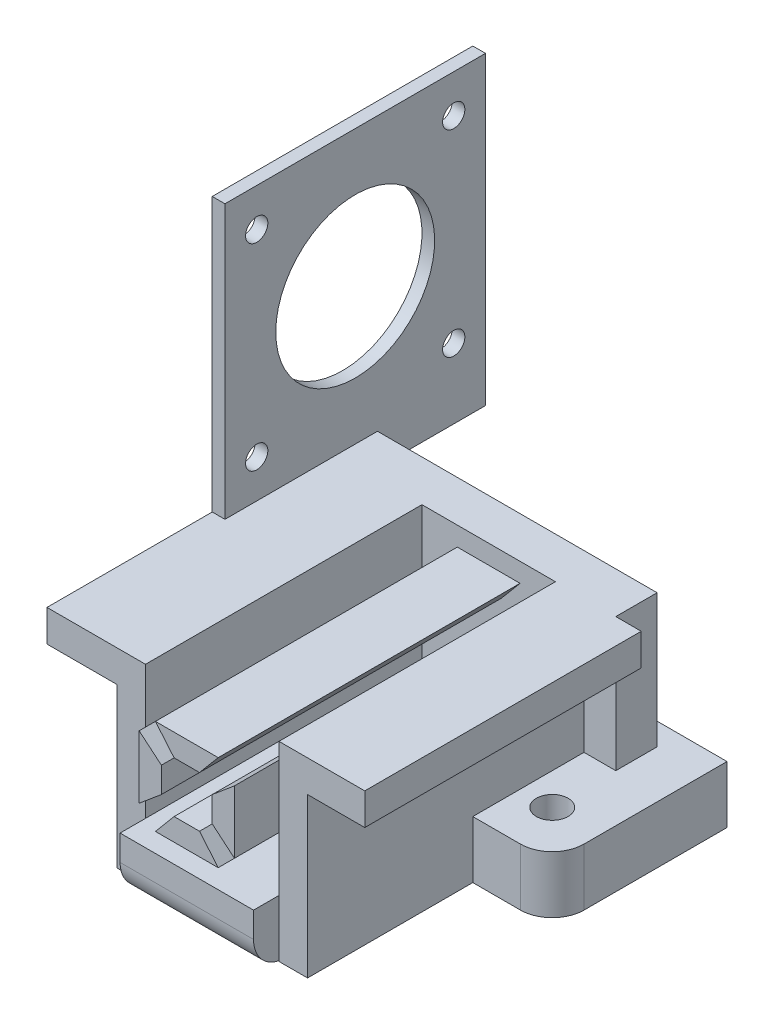
from build123d import *

# Parameters (mm, degrees)
BOSS_EXTRUDE2_DEPTH          = 8
BOSS_EXTRUDE2_DEPTH_BACK     = 1
SKETCH1_R                    = 2.5
CUT_EXTRUDE1_DEPTH           = 79.300702423
CUT_EXTRUDE1_DEPTH_BACK      = 79.300702423
SKETCH2_R                    = 2.5
SKETCH3_R                    = 3.25
CUT_EXTRUDE5_DEPTH           = 15
CUT_EXTRUDE5_DRAFT           = -0.0573
CUT_EXTRUDE5_PROFILE_2_DEPTH = 15
CUT_EXTRUDE5_PROFILE_2_DRAFT = -0.0573
SKETCH5_W                    = 4.5
SKETCH5_H                    = 6.5
BOSS_EXTRUDE3_DEPTH          = 14.5
SKETCH6_R                    = 4
CUT_EXTRUDE4_DEPTH           = 1.5
SKETCH12_W                   = 10.5
SKETCH12_H                   = 30
BOSS_EXTRUDE7_DEPTH          = 9
SKETCH15_W                   = 9
SKETCH15_H                   = 6.5
BOSS_EXTRUDE8_DEPTH          = 3.5
BOSS_EXTRUDE9_DEPTH          = 54
FILLET4_R                    = 5
SKETCH18_W                   = 9.873697418
SKETCH18_H                   = 6.5
BOSS_EXTRUDE11_DEPTH         = 0.5
SKETCH20_W                   = 4
SKETCH20_H                   = 17.5
BOSS_EXTRUDE12_DEPTH         = 18
BOSS_EXTRUDE13_DEPTH         = 11
BOSS_EXTRUDE13_DEPTH_BACK    = 4
SKETCH22_W                   = 17.5
SKETCH22_H                   = 4
SKETCH25_W                   = 2
SKETCH25_H                   = 17.5
BOSS_EXTRUDE14_DEPTH         = 41
SKETCH28_W                   = 41
SKETCH28_H                   = 45
BOSS_EXTRUDE15_DEPTH         = 2
SKETCH29_R                   = 1.75
CUT_EXTRUDE8_DEPTH           = 9
BOSS_EXTRUDE16_DEPTH         = 9
BOSS_EXTRUDE16_DEPTH_BACK    = 4
SKETCH30_W                   = 17.5
SKETCH30_H                   = 2
CUT_EXTRUDE9_DEPTH           = 9
SKETCH32_W                   = 13
SKETCH32_H                   = 4
BOSS_EXTRUDE17_DEPTH         = 23.5
SKETCH33_W                   = 0.5
SKETCH33_H                   = 17.5
BOSS_EXTRUDE18_DEPTH         = 20
SKETCH34_W                   = 4.5
SKETCH34_H                   = 25
SKETCH34_W_2                 = 15.5
SKETCH34_H_2                 = 4
SKETCH34_W_3                 = 9
BOSS_EXTRUDE19_DEPTH         = 26
SKETCH35_W                   = 9.873697418
SKETCH35_H                   = 0.5
BOSS_EXTRUDE20_DEPTH         = 47.5
BOSS_EXTRUDE21_DEPTH         = 47.5
SKETCH38_W                   = 0.419549816
SKETCH38_H                   = 18.5
CUT_EXTRUDE10_DEPTH          = 90.5
SKETCH46_W                   = 22.5
SKETCH46_H                   = 9
SKETCH46_W_2                 = 5
BOSS_EXTRUDE26_DEPTH         = 11.5
SKETCH47_W                   = 27.5
SKETCH47_H                   = 9
BOSS_EXTRUDE27_DEPTH         = 11
SKETCH48_W                   = 5
SKETCH48_H                   = 6.5
BOSS_EXTRUDE31_DEPTH         = 18.5
SKETCH50_R                   = 4
CUT_EXTRUDE11_DEPTH          = 1.5
SKETCH51_W                   = 9.626242636
SKETCH51_H                   = 9.125298808
BOSS_EXTRUDE32_DEPTH         = 1.5
BOSS_EXTRUDE35_DEPTH         = 47.5
SKETCH55_W                   = 9.873697418
SKETCH55_H                   = 0.5
CUT_EXTRUDE12_DEPTH          = 47.5
BOSS_EXTRUDE37_DEPTH         = 47.5
CUT_EXTRUDE17_DEPTH          = 47.5
SKETCH62_W                   = 8
SKETCH62_H                   = 8
CUT_EXTRUDE18_DEPTH          = 47.5
SKETCH63_W                   = 13
SKETCH63_H                   = 4
CUT_EXTRUDE20_DEPTH          = 17
SKETCH64_W                   = 0.5
SKETCH64_H                   = 1.5
BOSS_EXTRUDE38_DEPTH         = 6.5
SKETCH65_W                   = 7
SKETCH65_H                   = 3
CUT_EXTRUDE21_DEPTH          = 1.5
BOSS_EXTRUDE39_START         = -2
BOSS_EXTRUDE39_DEPTH         = 2
CUT_EXTRUDE22_DEPTH          = 155
BOSS_EXTRUDE40_DEPTH         = 1.5
SKETCH70_W                   = 2
SKETCH70_H                   = 41
BOSS_EXTRUDE41_DEPTH         = 3
BOSS_EXTRUDE42_DEPTH         = 1


with BuildPart() as part:
    # Sketch1 → Boss-Extrude2 (new, two sides: drawn at the far end of the back side and taken through both)
    with BuildSketch(Plane(origin=(0, 0, 0), x_dir=(1, 0, 0), z_dir=(0, 1, 0)).offset(-BOSS_EXTRUDE2_DEPTH_BACK)):
        with BuildLine():
            Line((5, 0), (50, 0))
            ThreePointArc((50, 0), (53.535533906, 1.464466094), (55, 5))
            Line((55, 5), (55, 50))
            ThreePointArc((55, 50), (53.535533906, 53.535533906), (50, 55))
            Line((50, 55), (5, 55))
            ThreePointArc((5, 55), (1.464466094, 53.535533906), (0, 50))
            Line((0, 50), (0, 5))
            ThreePointArc((0, 5), (1.464466094, 1.464466094), (5, 0))
        make_face()
        with Locations(Location((7.5, 47.5, 0), (0, 0, 270))):
            Circle(SKETCH1_R, mode=Mode.SUBTRACT)
        with Locations(Location((47.5, 47.5, 0), (0, 0, 270))):
            Circle(SKETCH1_R, mode=Mode.SUBTRACT)
        with Locations(Location((47.5, 7.5, 0), (0, 0, 270))):
            Circle(SKETCH1_R, mode=Mode.SUBTRACT)
        with Locations(Location((7.5, 7.5, 0), (0, 0, 270))):
            Circle(SKETCH1_R, mode=Mode.SUBTRACT)
    extrude(amount=BOSS_EXTRUDE2_DEPTH + BOSS_EXTRUDE2_DEPTH_BACK)

    # Sketch2 → Cut-Extrude1 (cut, two sides: drawn at the far end of the back side and taken through both)
    with BuildSketch(Plane(origin=(0, 8, 0), x_dir=(1, 0, 0), z_dir=(0, 1, 0)).offset(-CUT_EXTRUDE1_DEPTH_BACK)):
        with BuildLine():
            Line((0, 50), (0, 27.5))
            Line((0, 27.5), (55, 27.5))
            Line((55, 27.5), (55, 50))
            ThreePointArc((55, 50), (53.535533906, 53.535533906), (50, 55))
            Line((50, 55), (5, 55))
            ThreePointArc((5, 55), (1.464466094, 53.535533906), (0, 50))
        make_face()
        with Locations((7.5, 47.5)):
            Circle(SKETCH2_R, mode=Mode.SUBTRACT)
        with Locations((47.5, 47.5)):
            Circle(SKETCH2_R, mode=Mode.SUBTRACT)
    extrude(amount=CUT_EXTRUDE1_DEPTH + CUT_EXTRUDE1_DEPTH_BACK, mode=Mode.SUBTRACT)


with BuildPart() as cut_extrude5_tool:
    # Sketch3 → Cut-Extrude5 (with draft: the straight prism first)
    with BuildSketch(Plane(origin=(0, 0, -27.5), x_dir=(-1, 0, 0), z_dir=(0, 0, -1))):
        with Locations((-37.5, 3.5)):
            Circle(SKETCH3_R)
    extrude(amount=-CUT_EXTRUDE5_DEPTH)
    # Cut-Extrude5: the draft: its side faces are tilted about the plane it starts from
    cut_extrude5_sides = [cut_extrude5_tool.faces().sort_by_distance(p)[0] for p in [
        (40.75, 3.5, -20),
    ]]
    draft(cut_extrude5_sides, Plane(origin=(0, 0, -27.5), x_dir=(-1, 0, 0), z_dir=(0, 0, -1)), CUT_EXTRUDE5_DRAFT)


with BuildPart() as part_1:
    add(part.part)

    # Cut-Extrude5: cut by cut_extrude5_tool
    add(cut_extrude5_tool.part, mode=Mode.SUBTRACT)


with BuildPart() as cut_extrude5_profile_2_tool:
    # Sketch3 → Cut-Extrude5 profile 2 (with draft: the straight prism first)
    with BuildSketch(Plane(origin=(0, 0, -27.5), x_dir=(-1, 0, 0), z_dir=(0, 0, -1))):
        with Locations((-17.5, 3.5)):
            Circle(SKETCH3_R)
    extrude(amount=-CUT_EXTRUDE5_PROFILE_2_DEPTH)
    # Cut-Extrude5 profile 2: the draft: its side faces are tilted about the plane it starts from
    cut_extrude5_profile_2_sides = [cut_extrude5_profile_2_tool.faces().sort_by_distance(p)[0] for p in [
        (20.75, 3.5, -20),
    ]]
    draft(cut_extrude5_profile_2_sides, Plane(origin=(0, 0, -27.5), x_dir=(-1, 0, 0), z_dir=(0, 0, -1)), CUT_EXTRUDE5_PROFILE_2_DRAFT)


with BuildPart() as part_2:
    add(part_1.part)

    # Cut-Extrude5 profile 2: cut by cut_extrude5_profile_2_tool
    add(cut_extrude5_profile_2_tool.part, mode=Mode.SUBTRACT)

    # Sketch5 → Boss-Extrude3 (add)
    with BuildSketch(Plane(origin=(0, 8, 0), x_dir=(1, 0, 0), z_dir=(0, 1, 0))):
        with Locations((25.25, 20.75)):
            Rectangle(SKETCH5_W, SKETCH5_H)
        with Locations((29.75, 20.75)):
            Rectangle(SKETCH5_W, SKETCH5_H)
    extrude(amount=BOSS_EXTRUDE3_DEPTH)

    # Sketch6 → Cut-Extrude4 (cut)
    with BuildSketch(Plane(origin=(0, 0, -24), x_dir=(-1, 0, 0), z_dir=(0, 0, -1))):
        with Locations((-27.5, 17)):
            Circle(SKETCH6_R)
    extrude(amount=-CUT_EXTRUDE4_DEPTH, mode=Mode.SUBTRACT)

    # Sketch12 → Boss-Extrude7 (add)
    with BuildSketch(Plane(origin=(0, 8, 0), x_dir=(1, 0, 0), z_dir=(0, 1, 0))):
        with Locations((32.75, -15)):
            Rectangle(SKETCH12_W, SKETCH12_H)
        with Locations((22.25, -15)):
            Rectangle(SKETCH12_W, SKETCH12_H)
    extrude(amount=-BOSS_EXTRUDE7_DEPTH)

    # Sketch15 → Boss-Extrude8 (add)
    with BuildSketch(Plane(origin=(0, 22.5, 0), x_dir=(1, 0, 0), z_dir=(0, 1, 0))):
        with Locations((27.5, 20.75)):
            Rectangle(SKETCH15_W, SKETCH15_H)
    extrude(amount=BOSS_EXTRUDE8_DEPTH)

    # Sketch11 → Boss-Extrude9 (add)
    with BuildSketch(Plane(origin=(0, 0, -24), x_dir=(-1, 0, 0), z_dir=(0, 0, -1))):
        Polygon((-32.436848709, 26), (-29.5, 22.5), (-29.5, 26), align=None)
        Polygon((-29.5, 22.5), (-27.5, 22.5), (-25.5, 22.5), (-25.5, 26), (-29.5, 26), align=None)
        Polygon((-25.5, 26), (-25.5, 22.5), (-22.563151291, 26), align=None)
    extrude(amount=-BOSS_EXTRUDE9_DEPTH)

    # Fillet4
    fillet4_edges = [part_2.edges().sort_by_distance(p)[0] for p in [
        (27.5, -1, 30),
    ]]
    fillet(fillet4_edges, radius=FILLET4_R)

    # Sketch18 → Boss-Extrude11 (add)
    with BuildSketch(Plane(origin=(0, 26, 0), x_dir=(1, 0, 0), z_dir=(0, 1, 0))):
        with Locations((27.5, 20.75)):
            Rectangle(SKETCH18_W, SKETCH18_H)
    extrude(amount=BOSS_EXTRUDE11_DEPTH)

    # Sketch20 → Boss-Extrude12 (add)
    with BuildSketch(Plane(origin=(0, 8, 0), x_dir=(1, 0, 0), z_dir=(0, 1, 0))):
        with Locations((14.5, 8.75)):
            Rectangle(SKETCH20_W, SKETCH20_H)
        with Locations((40.5, 8.75)):
            Rectangle(SKETCH20_W, SKETCH20_H)
    extrude(amount=BOSS_EXTRUDE12_DEPTH)

    # Sketch22 → Boss-Extrude13 (add, two sides: drawn at the far end of the back side and taken through both)
    with BuildSketch(Plane.ZY.offset(-12.5).offset(-BOSS_EXTRUDE13_DEPTH_BACK)):
        with Locations((-8.75, 26)):
            Rectangle(SKETCH22_W, SKETCH22_H)
    extrude(amount=BOSS_EXTRUDE13_DEPTH + BOSS_EXTRUDE13_DEPTH_BACK)

    # Sketch25 → Boss-Extrude14 (add)
    with BuildSketch(Plane(origin=(0, 28, 0), x_dir=(1, 0, 0), z_dir=(0, 1, 0))):
        with Locations((2.5, 8.75)):
            Rectangle(SKETCH25_W, SKETCH25_H)
    extrude(amount=BOSS_EXTRUDE14_DEPTH)

    # Sketch28 → Boss-Extrude15 (add)
    with BuildSketch(Plane.ZY.offset(-1.5)):
        with Locations((-20.5, 46.5)):
            Rectangle(SKETCH28_W, SKETCH28_H)
    extrude(amount=-BOSS_EXTRUDE15_DEPTH)

    # Sketch29 → Cut-Extrude8 (cut)
    with BuildSketch(Plane.ZY.offset(-1.5)):
        with Locations((-36, 35)):
            Circle(SKETCH29_R)
        with Locations((-5, 66)):
            Circle(SKETCH29_R)
        with Locations((-5, 35)):
            Circle(SKETCH29_R)
        with Locations((-36, 66)):
            Circle(SKETCH29_R)
    extrude(amount=-CUT_EXTRUDE8_DEPTH, mode=Mode.SUBTRACT)

    # Sketch30 → Boss-Extrude16 (add, two sides: drawn at the far end of the back side and taken through both)
    with BuildSketch(Plane(origin=(42.5, 0, 0), x_dir=(0, 0, -1), z_dir=(1, 0, 0)).offset(-BOSS_EXTRUDE16_DEPTH_BACK)):
        with Locations((8.75, 25)):
            Rectangle(SKETCH30_W, SKETCH30_H)
        with Locations((8.75, 27)):
            Rectangle(SKETCH30_W, SKETCH30_H)
    extrude(amount=BOSS_EXTRUDE16_DEPTH + BOSS_EXTRUDE16_DEPTH_BACK)

    # Sketch31 → Cut-Extrude9 (cut)
    with BuildSketch(Plane(origin=(3.5, 0, 0), x_dir=(0, 0, -1), z_dir=(1, 0, 0))):
        with BuildLine():
            ThreePointArc((30.5, 47), (27.571067812, 54.071067812), (20.5, 57))
            Line((20.5, 57), (20.5, 47))
            Line((20.5, 47), (30.5, 47))
        make_face()
        with BuildLine():
            Line((20.5, 47), (20.5, 57))
            ThreePointArc((20.5, 57), (13.428932188, 39.928932188), (30.5, 47))
            Line((30.5, 47), (20.5, 47))
        make_face()
    extrude(amount=-CUT_EXTRUDE9_DEPTH, mode=Mode.SUBTRACT)

    # Sketch32 → Boss-Extrude17 (add)
    with BuildSketch(Plane(origin=(0, 0, -17.5), x_dir=(-1, 0, 0), z_dir=(0, 0, -1))):
        with Locations((-10, 26)):
            Rectangle(SKETCH32_W, SKETCH32_H)
    extrude(amount=BOSS_EXTRUDE17_DEPTH)

    # Sketch33 → Boss-Extrude18 (add)
    with BuildSketch(Plane(origin=(0, 8, 0), x_dir=(1, 0, 0), z_dir=(0, 1, 0))):
        with Locations((38.25, 8.75)):
            Rectangle(SKETCH33_W, SKETCH33_H)
        with Locations((16.75, 8.75)):
            Rectangle(SKETCH33_W, SKETCH33_H)
    extrude(amount=BOSS_EXTRUDE18_DEPTH)

    # Sketch34 → Boss-Extrude19 (add)
    with BuildSketch(Plane.XY):
        with Locations((14.75, 11.5)):
            Rectangle(SKETCH34_W, SKETCH34_H)
        with Locations((9.25, 26)):
            Rectangle(SKETCH34_W_2, SKETCH34_H_2)
        Polygon((42.5, 24), (42.5, 28), (38, 28), (38, 8), (38, -1), (42.5, -1), (42.5, 8), align=None)
        with Locations((47, 26)):
            Rectangle(SKETCH34_W_3, SKETCH34_H_2)
    extrude(amount=BOSS_EXTRUDE19_DEPTH)

    # Sketch35 → Boss-Extrude20 (add)
    with BuildSketch(Plane.XY.offset(-17.5)):
        with Locations((27.5, 26.25)):
            Rectangle(SKETCH35_W, SKETCH35_H)
    extrude(amount=BOSS_EXTRUDE20_DEPTH)

    # Sketch37 → Boss-Extrude21 (add)
    with BuildSketch(Plane.XY.offset(-17.5)):
        Polygon((23, 8), (25.5, 8), (25.5, 12), (23, 9.020616019), align=None)
        Polygon((25.5, 8), (27.5, 8), (29.5, 8), (29.5, 12), (25.5, 12), align=None)
        Polygon((29.5, 12), (29.5, 8), (32, 8), (32, 9.020616019), align=None)
        Polygon((29.5, 8), (27.5, 8), (25.5, 8), (23, 8), (23, 9.020616019), (21.863844179, 7.666598237), (33.136155821, 7.666598237), (32, 9.020616019), (32, 8), align=None)
    extrude(amount=BOSS_EXTRUDE21_DEPTH)

    # Sketch38 → Cut-Extrude10 (cut)
    with BuildSketch(Plane.XY.offset(30)):
        with Locations((22.353376383, 17.25)):
            Rectangle(SKETCH38_W, SKETCH38_H)
        with Locations((32.646623617, 17.25)):
            Rectangle(SKETCH38_W, SKETCH38_H)
    extrude(amount=-CUT_EXTRUDE10_DEPTH, mode=Mode.SUBTRACT)

    # Sketch46 → Boss-Extrude26 (add)
    with BuildSketch(Plane.ZY):
        with Locations((-16.25, 3.5)):
            Rectangle(SKETCH46_W, SKETCH46_H)
        with Locations((-2.5, 3.5)):
            Rectangle(SKETCH46_W_2, SKETCH46_H)
    extrude(amount=-BOSS_EXTRUDE26_DEPTH)

    # Sketch47 → Boss-Extrude27 (add)
    with BuildSketch(Plane.ZY):
        with Locations((-13.75, 3.5)):
            Rectangle(SKETCH47_W, SKETCH47_H)
    extrude(amount=BOSS_EXTRUDE27_DEPTH)

    # Sketch48 → Boss-Extrude31 (add)
    with BuildSketch(Plane(origin=(0, 8, 0), x_dir=(1, 0, 0), z_dir=(0, 1, 0))):
        Polygon((42.5, 17.5), (42.5, 24), (32, 24), (32, 17.5), (32.436848709, 17.5), (38, 17.5), align=None)
        with Locations((45, 20.75)):
            Rectangle(SKETCH48_W, SKETCH48_H)
        Polygon((12.5, 24), (12.5, 17.5), (17, 17.5), (22.563151291, 17.5), (23, 17.5), (23, 24), align=None)
        with Locations((10, 20.75)):
            Rectangle(SKETCH48_W, SKETCH48_H)
    extrude(amount=BOSS_EXTRUDE31_DEPTH)

    # Sketch50 → Cut-Extrude11 (cut)
    with BuildSketch(Plane(origin=(0, 0, -24), x_dir=(-1, 0, 0), z_dir=(0, 0, -1))):
        with Locations((-17.5, 17)):
            Circle(SKETCH50_R)
        with Locations((-37.5, 17)):
            Circle(SKETCH50_R)
    extrude(amount=-CUT_EXTRUDE11_DEPTH, mode=Mode.SUBTRACT)

    # Sketch51 → Boss-Extrude32 (add)
    with BuildSketch(Plane(origin=(0, 0, -24), x_dir=(-1, 0, 0), z_dir=(0, 0, -1))):
        with Locations((-27.646184708, 17.114099589)):
            Rectangle(SKETCH51_W, SKETCH51_H)
    extrude(amount=-BOSS_EXTRUDE32_DEPTH)

    # Sketch54 → Boss-Extrude35 (add)
    with BuildSketch(Plane.XY.offset(-17.5)):
        Polygon((29.5, 22.5), (27.5, 22.5), (27.5, 14.5), (31.5, 14.5), (31.5, 22.5), align=None)
        Polygon((27.5, 14.5), (27.5, 22.5), (25.5, 22.5), (23.5, 22.5), (23.5, 14.5), align=None)
    extrude(amount=BOSS_EXTRUDE35_DEPTH)

    # Sketch55 → Cut-Extrude12 (cut)
    with BuildSketch(Plane.XY.offset(30)):
        with Locations((27.5, 26.25)):
            Rectangle(SKETCH55_W, SKETCH55_H)
    extrude(amount=-CUT_EXTRUDE12_DEPTH, mode=Mode.SUBTRACT)

    # Sketch57 → Boss-Extrude37 (add)
    with BuildSketch(Plane.XY.offset(30)):
        Polygon((35, 23.436848709), (31.5, 20.5), (31.5, 20.428787517), (35, 20.428787517), align=None)
        Polygon((35, 20.428787517), (31.5, 20.428787517), (31.5, 18.5), (35, 18.5), (35, 18.535606241), align=None)
        Polygon((35, 18.5), (31.5, 18.5), (31.5, 16.5), (35, 16.5), (35, 18.464393759), align=None)
        Polygon((35, 16.5), (31.5, 16.5), (35, 13.563151291), align=None)
        Polygon((32.436848709, 11), (29.5, 14.5), (25.5, 14.5), (22.563151291, 11), align=None)
        Polygon((20, 16.5), (23.5, 16.5), (23.5, 18.5), (23.5, 20.5), (20, 23.436848709), (20, 18.535606241), (20, 18.464393759), align=None)
        Polygon((20, 13.563151291), (23.5, 16.5), (20, 16.5), align=None)
    extrude(amount=-BOSS_EXTRUDE37_DEPTH)

    # Sketch61 → Cut-Extrude17 (cut)
    with BuildSketch(Plane.XY.offset(30)):
        Polygon((32.436848709, 8), (22.563151291, 8), (22.563151291, 8.5), (24.660900369, 11), (30.339099631, 11), (32.436848709, 8.5), align=None)
    extrude(amount=-CUT_EXTRUDE17_DEPTH, mode=Mode.SUBTRACT)

    # Sketch62 → Cut-Extrude18 (cut)
    with BuildSketch(Plane.XY.offset(30)):
        with Locations((27.5, 18.5)):
            Rectangle(SKETCH62_W, SKETCH62_H)
    extrude(amount=-CUT_EXTRUDE18_DEPTH, mode=Mode.SUBTRACT)

    # Sketch63 → Cut-Extrude20 (cut)
    with BuildSketch(Plane(origin=(0, 0, -41), x_dir=(-1, 0, 0), z_dir=(0, 0, -1))):
        with Locations((-10, 26)):
            Rectangle(SKETCH63_W, SKETCH63_H)
    extrude(amount=-CUT_EXTRUDE20_DEPTH, mode=Mode.SUBTRACT)

    # Sketch64 → Boss-Extrude38 (add)
    with BuildSketch(Plane(origin=(0, 0, -17.5), x_dir=(-1, 0, 0), z_dir=(0, 0, -1))):
        with Locations((-16.75, 27.25)):
            Rectangle(SKETCH64_W, SKETCH64_H)
    extrude(amount=BOSS_EXTRUDE38_DEPTH)

    # Sketch65 → Cut-Extrude21 (cut)
    with BuildSketch(Plane(origin=(0, 28, 0), x_dir=(1, 0, 0), z_dir=(0, 1, 0))):
        with Locations((48, 16)):
            Rectangle(SKETCH65_W, SKETCH65_H)
    extrude(amount=-CUT_EXTRUDE21_DEPTH, mode=Mode.SUBTRACT)

    # Sketch66 → Boss-Extrude39 (add)
    with BuildSketch(Plane.ZY.offset(-1.5).offset(BOSS_EXTRUDE39_START)):
        with BuildLine():
            ThreePointArc((-30.5, 47), (-20.5, 37), (-10.5, 47))
            Line((-10.5, 47), (-30.5, 47))
        make_face()
        with BuildLine():
            Line((-30.5, 47), (-10.5, 47))
            ThreePointArc((-10.5, 47), (-20.5, 57), (-30.5, 47))
        make_face()
    extrude(amount=BOSS_EXTRUDE39_DEPTH)

    # Sketch67 → Cut-Extrude22 (cut)
    with BuildSketch(Plane.ZY.offset(-1.5)):
        with BuildLine():
            ThreePointArc((-33, 50.5), (-29.338834765, 41.661165235), (-20.5, 38))
            Line((-20.5, 38), (-20.5, 50.5))
            Line((-20.5, 50.5), (-33, 50.5))
        make_face()
        with BuildLine():
            Line((-20.5, 50.5), (-20.5, 38))
            ThreePointArc((-20.5, 38), (-11.661165235, 41.661165235), (-8, 50.5))
            Line((-8, 50.5), (-20.5, 50.5))
        make_face()
        with BuildLine():
            Line((-33, 50.5), (-20.5, 50.5))
            Line((-20.5, 50.5), (-20.5, 63))
            ThreePointArc((-20.5, 63), (-29.338834765, 59.338834765), (-33, 50.5))
        make_face()
        with BuildLine():
            Line((-20.5, 63), (-20.5, 50.5))
            Line((-20.5, 50.5), (-8, 50.5))
            ThreePointArc((-8, 50.5), (-11.661165235, 59.338834765), (-20.5, 63))
        make_face()
    extrude(amount=-CUT_EXTRUDE22_DEPTH, mode=Mode.SUBTRACT)

    # Sketch69 → Boss-Extrude40 (add)
    with BuildSketch(Plane(origin=(0, 26.5, 0), x_dir=(1, 0, 0), z_dir=(0, 1, 0))):
        Polygon((44.5, 14.5), (51.5, 14.5), (51.5, 17.5), (47.5, 17.5), (47.5, 24), (17, 24), (17, 17.5), (44.5, 17.5), align=None)
    extrude(amount=BOSS_EXTRUDE40_DEPTH)

    # Sketch70 → Boss-Extrude41 (add)
    with BuildSketch(Plane(origin=(0, 69, 0), x_dir=(1, 0, 0), z_dir=(0, 1, 0))):
        with Locations((2.5, 20.5)):
            Rectangle(SKETCH70_W, SKETCH70_H)
    extrude(amount=BOSS_EXTRUDE41_DEPTH)

    # Sketch72 → Boss-Extrude42 (add)
    with BuildSketch(Plane(origin=(0, 28, 0), x_dir=(1, 0, 0), z_dir=(0, 1, 0))):
        Polygon((17, -26), (1.5, -26), (1.5, 0), (1.5, 24), (47.5, 24), (47.5, 17.5), (51.5, 17.5), (51.5, -26), (38, -26), (38, 17.5), (17, 17.5), align=None)
    extrude(amount=BOSS_EXTRUDE42_DEPTH)


solid = part_2.part
